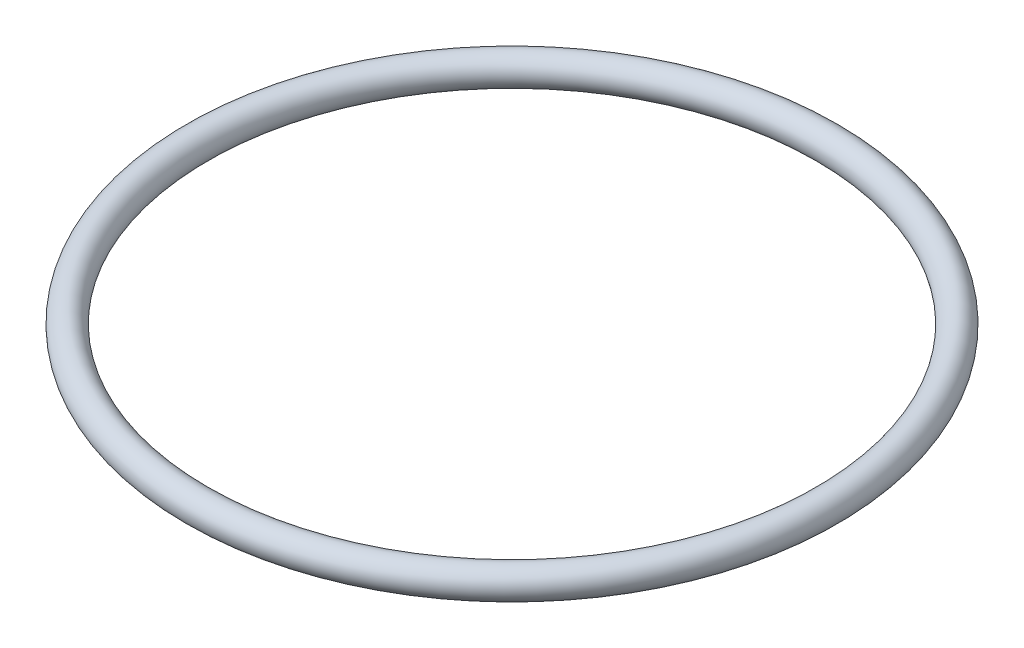
from build123d import *

# Parameters (mm, degrees)
SKETCH2_R = 1


with BuildPart() as part:
    # Sketch2 → Revolve1 (revolve)
    with BuildSketch(Plane.XY, mode=Mode.PRIVATE) as revolve1_sk:
        with Locations((21, 0)):
            Circle(SKETCH2_R)
    revolve(revolve1_sk.sketch.rotate(Axis((0, 0, 0), (0, 1, 0)), 90), axis=Axis((0, 0, 0), (0, 1, 0)))


solid = part.part
